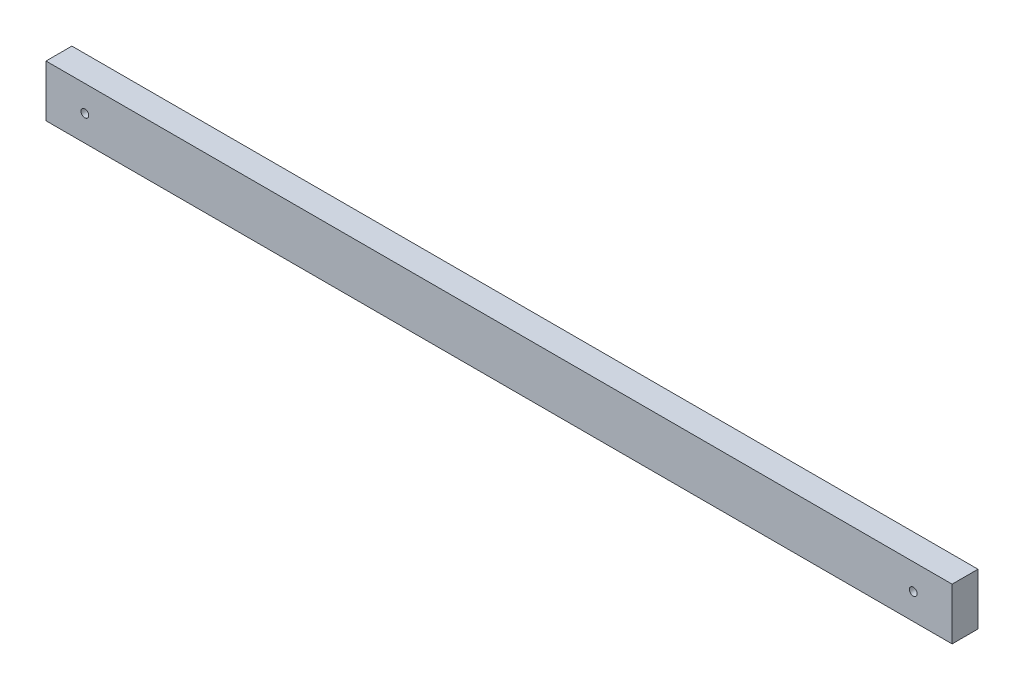
from build123d import *

# Parameters (mm, degrees)
SKETCH1_W           = 350
SKETCH1_H           = 20
BOSS_EXTRUDE1_DEPTH = 10
SKETCH2_R           = 1.5
CUT_EXTRUDE1_DEPTH  = 176.570498661


with BuildPart() as part:
    # Sketch1 → Boss-Extrude1 (new body)
    with BuildSketch(Plane.XY):
        Rectangle(SKETCH1_W, SKETCH1_H)
    extrude(amount=BOSS_EXTRUDE1_DEPTH)

    # Sketch2 → Cut-Extrude1 (cut, through all)
    with BuildSketch(Plane.XY.offset(10)):
        with Locations((-160, 0)):
            Circle(SKETCH2_R)
        with Locations(Location((160, 0, 0), (0, 0, 180))):
            Circle(SKETCH2_R)
    extrude(amount=-CUT_EXTRUDE1_DEPTH, mode=Mode.SUBTRACT)


solid = part.part
